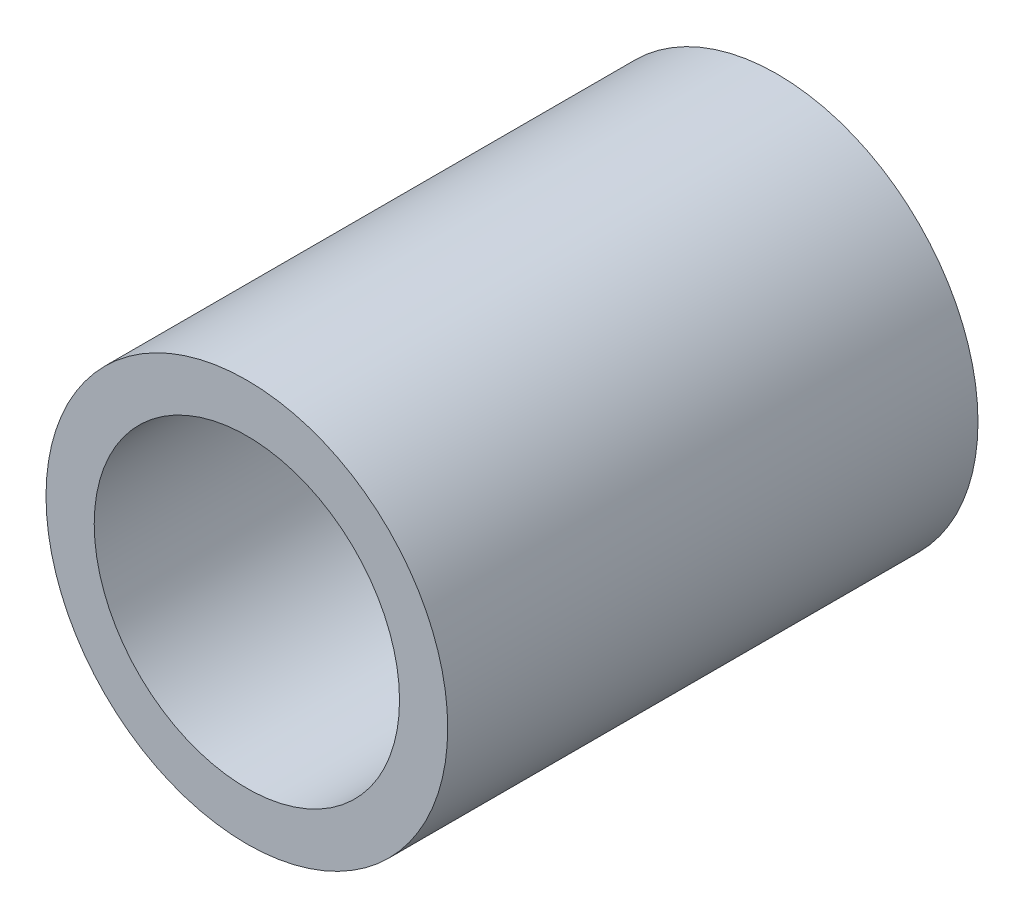
from build123d import *

# Parameters (mm, degrees)
SKETCH_1_R      = 2.5
SKETCH_1_R_2    = 1.9
EXTRUDE_1_DEPTH = 6.6


with BuildPart() as part:
    # 草图1 → 凸台-拉伸1 (new body)
    with BuildSketch(Plane.XY):
        Circle(SKETCH_1_R)
        Circle(SKETCH_1_R_2, mode=Mode.SUBTRACT)
    extrude(amount=EXTRUDE_1_DEPTH)


solid = part.part
